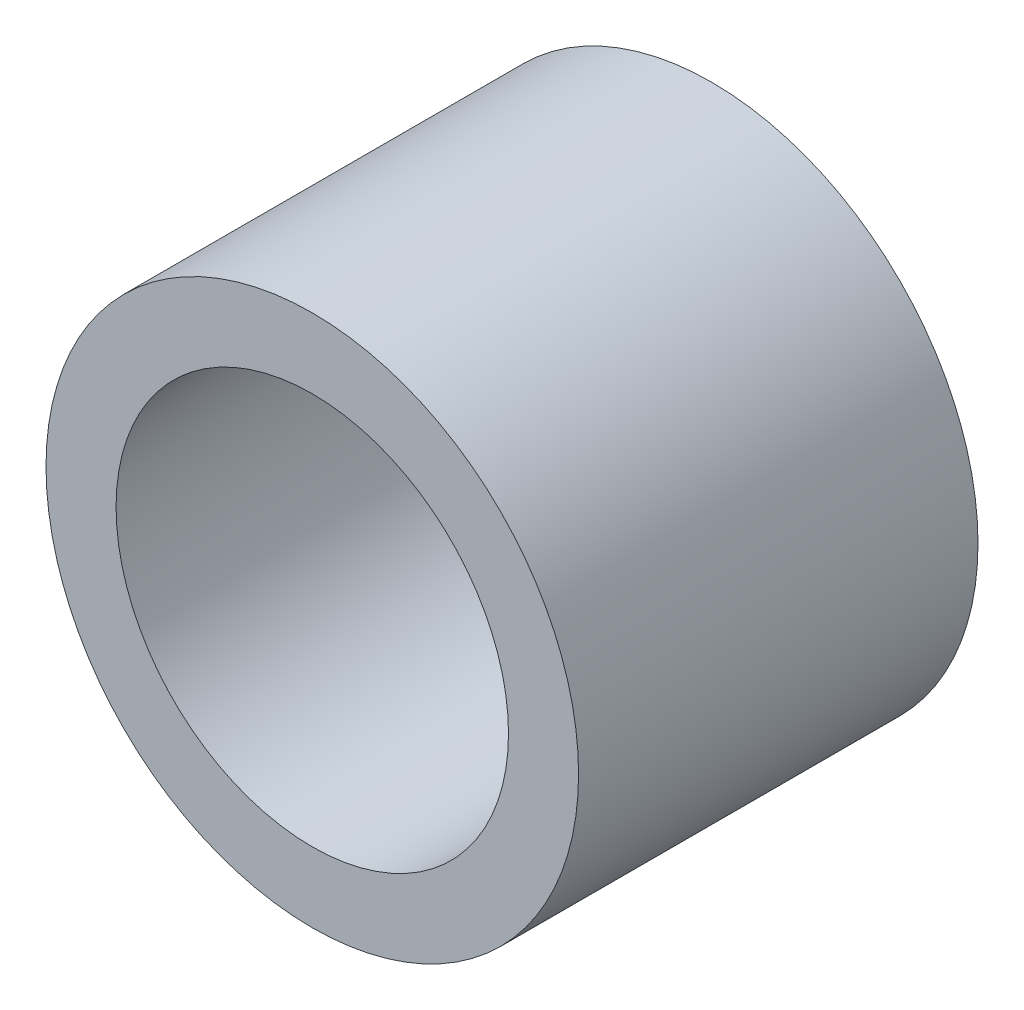
from build123d import *

# Parameters (mm, degrees)
SKETCH1_R           = 3.8
SKETCH1_R_2         = 2.8
BOSS_EXTRUDE1_DEPTH = 5.7


with BuildPart() as part:
    # Sketch1 → Boss-Extrude1 (new body)
    with BuildSketch(Plane.XY):
        Circle(SKETCH1_R)
        Circle(SKETCH1_R_2, mode=Mode.SUBTRACT)
    extrude(amount=BOSS_EXTRUDE1_DEPTH)


solid = part.part
